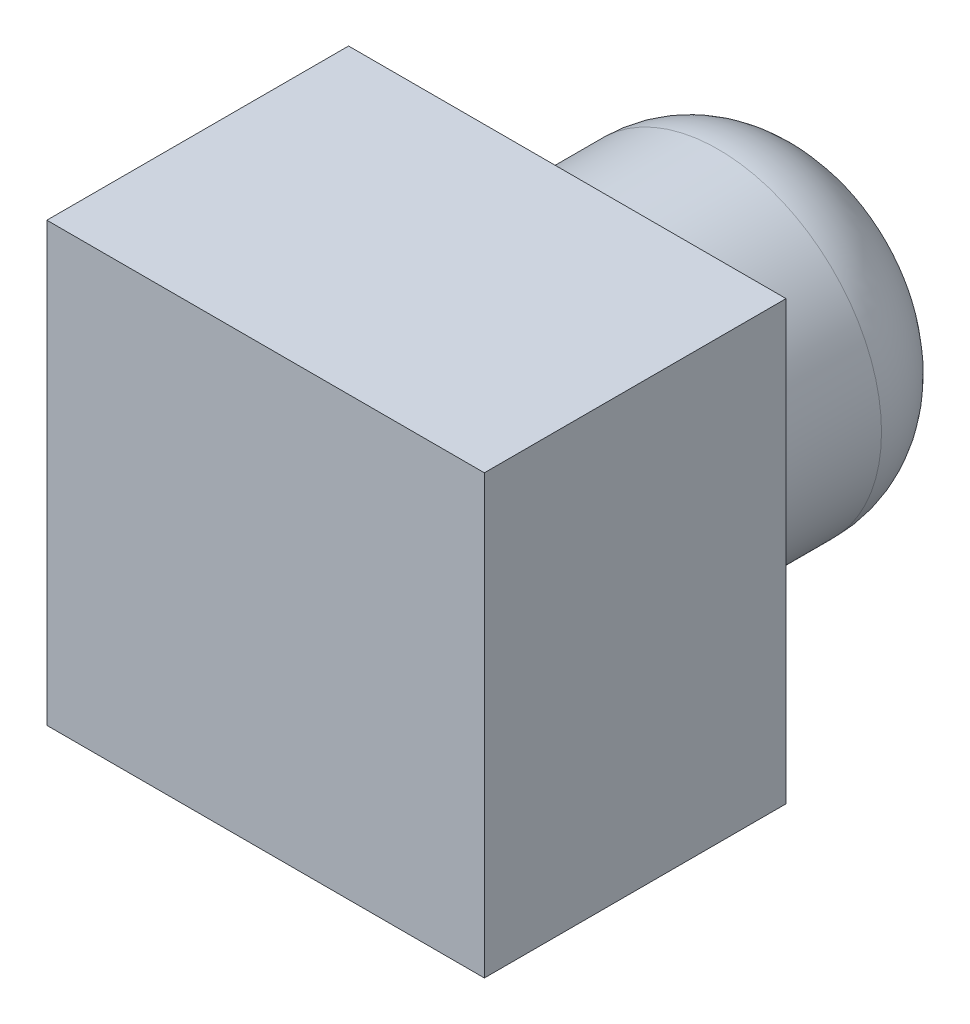
from build123d import *

# Parameters (mm, degrees)
SKETCH1_W           = 2.21
SKETCH1_H           = 2.21
BOSS_EXTRUDE1_DEPTH = 1.524
SKETCH2_R           = 0.825
BOSS_EXTRUDE2_DEPTH = 1.27
FILLET1_R           = 0.508


with BuildPart() as part:
    # Sketch1 → Boss-Extrude1 (new body)
    with BuildSketch(Plane.XY):
        Rectangle(SKETCH1_W, SKETCH1_H)
    extrude(amount=BOSS_EXTRUDE1_DEPTH)

    # Sketch2 → Boss-Extrude2 (add)
    with BuildSketch(Plane(origin=(0, 0, 0), x_dir=(-1, 0, 0), z_dir=(0, 0, -1))):
        Circle(SKETCH2_R)
    extrude(amount=BOSS_EXTRUDE2_DEPTH)

    # Fillet1
    fillet1_edges = [part.edges().sort_by_distance(p)[0] for p in [
        (0.825, 0, -1.27),
    ]]
    fillet(fillet1_edges, radius=FILLET1_R)


solid = part.part
